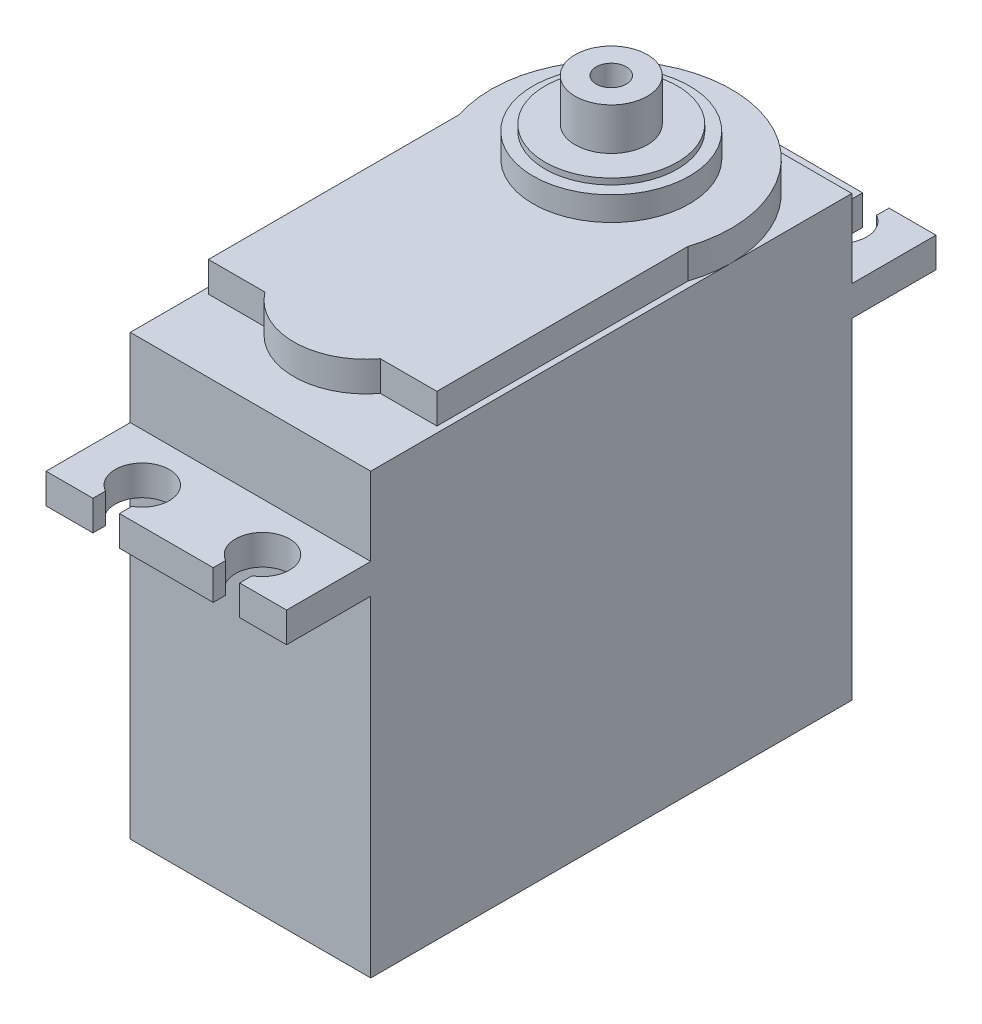
from build123d import *

# Parameters (mm, degrees)
SKETCH_1_W      = 20
SKETCH_1_H      = 40
EXTRUDE_1_DEPTH = 36.5
EXTRUDE_2_DEPTH = 2.5
SKETCH_3_R      = 6.5
EXTRUDE_3_DEPTH = 2
SKETCH_4_R      = 5.5
EXTRUDE_4_DEPTH = 0.5
SKETCH_5_R      = 3
SKETCH_5_R_2    = 1.25
EXTRUDE_5_DEPTH = 3.5
EXTRUDE_6_DEPTH = 2.5


with BuildPart() as part:
    # 草图1 → 凸台-拉伸1 (new body)
    with BuildSketch(Plane(origin=(0, 0, 0), x_dir=(1, 0, 0), z_dir=(0, 1, 0))):
        Rectangle(SKETCH_1_W, SKETCH_1_H)
    extrude(amount=EXTRUDE_1_DEPTH)

    # 草图2 → 凸台-拉伸2 (add)
    with BuildSketch(Plane(origin=(0, 36.5, 0), x_dir=(1, 0, 0), z_dir=(0, 1, 0))):
        with BuildLine():
            Line((-9.5, 6.877501001), (-9.5, -14))
            Line((-9.5, -14), (-4.797030686, -14))
            ThreePointArc((-4.797030686, -14), (0, -16.396044313), (4.797030686, -14))
            Line((4.797030686, -14), (9.5, -14))
            Line((9.5, -14), (9.5, 6.877501001))
            ThreePointArc((9.5, 6.877501001), (0, 20), (-9.5, 6.877501001))
        make_face()
    extrude(amount=EXTRUDE_2_DEPTH)

    # 草图3 → 凸台-拉伸3 (add)
    with BuildSketch(Plane(origin=(0, 39, 0), x_dir=(1, 0, 0), z_dir=(0, 1, 0))):
        with Locations(Location((0, 10, 0), (0, 0, 270))):
            Circle(SKETCH_3_R)
    extrude(amount=EXTRUDE_3_DEPTH)

    # 草图4 → 凸台-拉伸4 (add)
    with BuildSketch(Plane(origin=(0, 41, 0), x_dir=(1, 0, 0), z_dir=(0, 1, 0))):
        with Locations(Location((0, 10, 0), (0, 0, 270))):
            Circle(SKETCH_4_R)
    extrude(amount=EXTRUDE_4_DEPTH)

    # 草图6 → 凸台-拉伸6 (add)
    with BuildSketch(Plane(origin=(0, 30, 0), x_dir=(-1, 0, 0), z_dir=(0, -1, 0))):
        with BuildLine():
            Line((10, 27), (6.1, 27))
            Line((6.1, 27), (6.1, 25.962778643))
            ThreePointArc((6.1, 25.962778643), (5, 21.75), (3.9, 25.962778643))
            Line((3.9, 25.962778643), (3.9, 27))
            Line((3.9, 27), (-3.9, 27))
            Line((-3.9, 27), (-3.9, 25.962778643))
            ThreePointArc((-3.9, 25.962778643), (-5, 21.75), (-6.1, 25.962778643))
            Line((-6.1, 25.962778643), (-6.1, 27))
            Line((-6.1, 27), (-10, 27))
            Line((-10, 27), (-10, 20))
            Line((-10, 20), (0, 20))
            Line((0, 20), (10, 20))
            Line((10, 20), (10, 27))
        make_face()
        with BuildLine():
            Line((-6.1, -27), (-10, -27))
            Line((-10, -27), (-10, -20))
            Line((-10, -20), (0, -20))
            Line((0, -20), (10, -20))
            Line((10, -20), (10, -27))
            Line((10, -27), (6.1, -27))
            Line((6.1, -27), (6.1, -25.962778643))
            ThreePointArc((6.1, -25.962778643), (5, -21.75), (3.9, -25.962778643))
            Line((3.9, -25.962778643), (3.9, -27))
            Line((3.9, -27), (-3.9, -27))
            Line((-3.9, -27), (-3.9, -25.962778643))
            ThreePointArc((-3.9, -25.962778643), (-5, -21.75), (-6.1, -25.962778643))
            Line((-6.1, -25.962778643), (-6.1, -27))
        make_face()
    extrude(amount=EXTRUDE_6_DEPTH)


with BuildPart() as body_2:
    # 草图5 → 凸台-拉伸5 (new body)
    with BuildSketch(Plane(origin=(0, 41.5, 0), x_dir=(1, 0, 0), z_dir=(0, 1, 0))):
        with Locations(Location((0, 10, 0), (0, 0, 270))):
            Circle(SKETCH_5_R)
        with Locations(Location((0, 10, 0), (0, 0, 270))):
            Circle(SKETCH_5_R_2, mode=Mode.SUBTRACT)
    extrude(amount=EXTRUDE_5_DEPTH)


solid = Compound([part.part, body_2.part])
